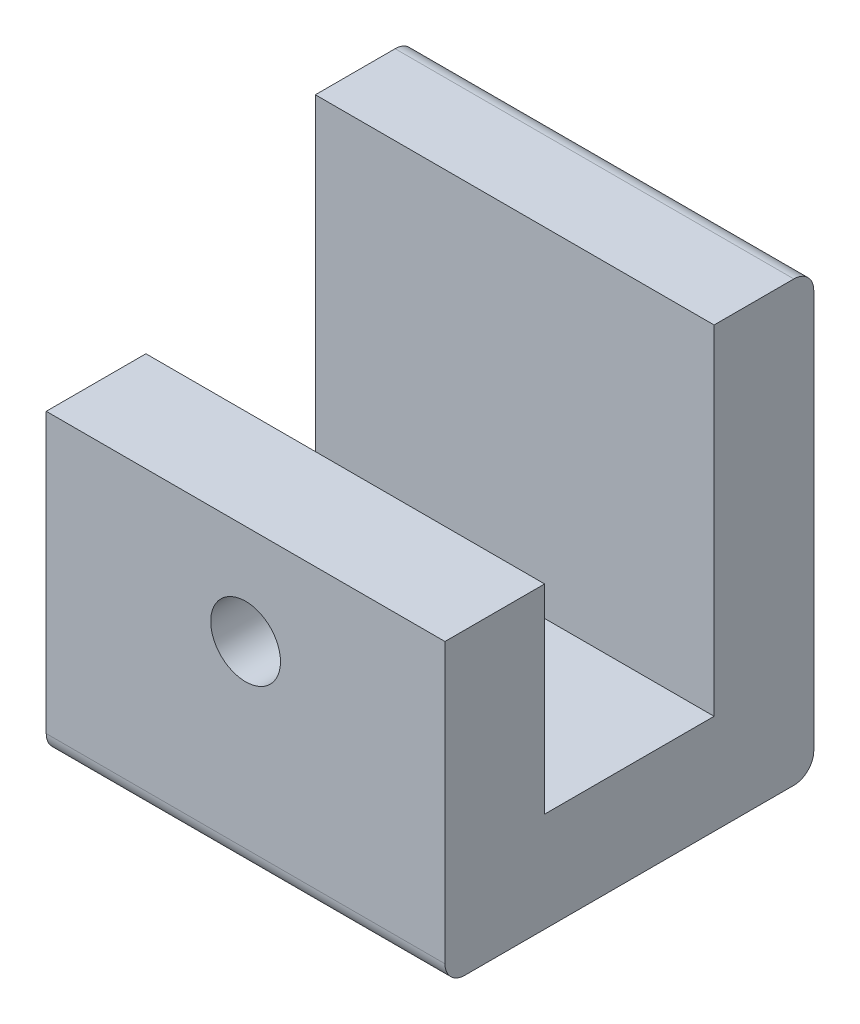
from build123d import *

# Parameters (mm, degrees)
SCHIZZO1_W                   = 20
SCHIZZO1_H                   = 15
SCHIZZO1_R                   = 1.75
ESTRUSIONE_ESTRUSIONE1_DEPTH = 5
SCHIZZO3_W                   = 20
SCHIZZO3_H                   = 5
ESTRUSIONE_ESTRUSIONE2_DEPTH = 13.5
SCHIZZO4_W                   = 20
SCHIZZO4_H                   = 5
ESTRUSIONE_ESTRUSIONE3_DEPTH = 17
RACCORDO1_R                  = 1


with BuildPart() as part:
    # Schizzo1 → Estrusione-Estrusione1 (new body)
    with BuildSketch(Plane.XY):
        Rectangle(SCHIZZO1_W, SCHIZZO1_H)
        with Locations((0, 2.5)):
            Circle(SCHIZZO1_R, mode=Mode.SUBTRACT)
    extrude(amount=ESTRUSIONE_ESTRUSIONE1_DEPTH)

    # Schizzo3 → Estrusione-Estrusione2 (add)
    with BuildSketch(Plane(origin=(0, 0, 0), x_dir=(-1, 0, 0), z_dir=(0, 0, -1))):
        with Locations((0, -5)):
            Rectangle(SCHIZZO3_W, SCHIZZO3_H)
    extrude(amount=ESTRUSIONE_ESTRUSIONE2_DEPTH)

    # Schizzo4 → Estrusione-Estrusione3 (add)
    with BuildSketch(Plane(origin=(0, -2.5, 0), x_dir=(1, 0, 0), z_dir=(0, 1, 0))):
        with Locations((0, 11)):
            Rectangle(SCHIZZO4_W, SCHIZZO4_H)
    extrude(amount=ESTRUSIONE_ESTRUSIONE3_DEPTH)

    # Raccordo1
    raccordo1_edges = [part.edges().sort_by_distance(p)[0] for p in [
        (0, -7.5, 5),
        (0, -7.5, -13.5),
        (0, 14.5, -13.5),
    ]]
    fillet(raccordo1_edges, radius=RACCORDO1_R)


solid = part.part
